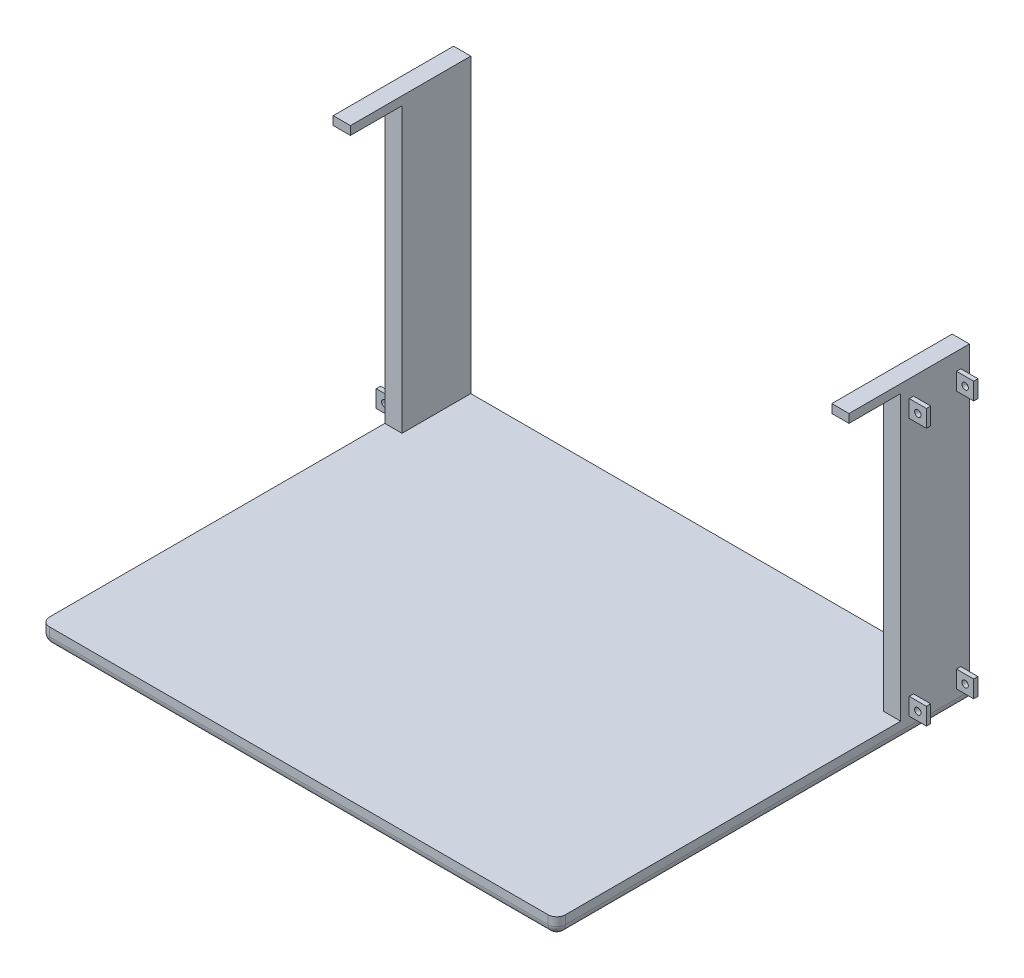
from build123d import *

# Parameters (mm, degrees)
SKETCH1_W                                      = 762
SKETCH1_H                                      = 381
BASE_STRUCTURE_DEPTH                           = 609.6
SKETCH3_W                                      = 711.2
SKETCH3_H                                      = 330.2
SHELL_CUT_DEPTH                                = 584.2
SKETCH5_W                                      = 25.4
SKETCH5_H                                      = 25.4
SKETCH5_R                                      = 4.7625
STABILITY_HOLDER_CUT_FOR_TOP_DEPTH             = 38.1
SKETCH7_W                                      = 63.5
SKETCH7_H                                      = 25.4
INSUDE_CUT_OF_STABILITY_HOLDERS_DEPTH          = 25.4
SKETCH14_W                                     = 711.2
SKETCH14_H                                     = 25.4
TOP_SHELLING_DEPTH                             = 406.4
SKETCH16_W                                     = 711.2
SKETCH16_H                                     = 50.8
BOTTOM_EXTENSION_DEPTH                         = 609.6
SKETCH16_6_W                                   = 711.2
SKETCH16_6_H                                   = 25.4
SKETCH16_6_H_2                                 = 50.8
BOTTOM_SHELLING_DEPTH                          = 584.2
SKETCH17_W                                     = 63.5
SKETCH17_H                                     = 25.4
BOTTOM_STABILTY_HOLDER_SHELL_CUT_DEPTH         = 25.4
SKETCH18_W                                     = 508
SKETCH18_H                                     = 406.4
F_3_4SHELL_FRONT_CHASSIS_CUT_DEPTH             = 1048.576803867
FILLET_CORNER_OF_FRONT_CHASSIS_R               = 12.7
SKETCH95_W                                     = 508
SKETCH95_H                                     = 25.4
CUT_TOP_EXTRUSION_OF_CHASSIS_DEPTH             = 1048.576803867
SKETCH171_W                                    = 76.290149759
SKETCH171_H                                    = 12.7
EXTRUSION_OF_STEERING_RACK_HOLDER_DEPTH        = 25.4
SKETCH172_W                                    = 76.2
SKETCH172_H                                    = 12.7
EXTRUSION_OF_OTHER_STEERING_RACK_HOLDER_DEPTH  = 25.4
MIRRORS_STABILITY_HOLDERS_COPY_1_SKETCH_W      = 25.4
MIRRORS_STABILITY_HOLDERS_COPY_1_SKETCH_H      = 25.4
MIRRORS_STABILITY_HOLDERS_COPY_1_SKETCH_R      = 4.7625
MIRRORS_STABILITY_HOLDERS_COPY_1_DEPTH         = 38.1
SKETCH173_W                                    = 63.5
SKETCH173_H                                    = 406.4
EXTRUSION_OF_OTHER_STABILITY_HOLDERS_TOP_DEPTH = 25.4
FILLET_OF_RIGHT_CORNER_OF_FRONT_CHASSIS_R      = 12.7
FILLET_OF_BOTTOM_SIDE_OF_FRONT_CHASSIS_R       = 12.7


with BuildPart() as part:
    # Sketch1 → Base Structure (new body)
    with BuildSketch(Plane.XY):
        with Locations((381, 190.5)):
            Rectangle(SKETCH1_W, SKETCH1_H)
    extrude(amount=-BASE_STRUCTURE_DEPTH)

    # Sketch3 → Shell Cut (cut)
    with BuildSketch(Plane(origin=(0, 0, -609.6), x_dir=(-1, 0, 0), z_dir=(0, 0, -1))):
        with Locations((-381, 190.5)):
            Rectangle(SKETCH3_W, SKETCH3_H)
    extrude(amount=-SHELL_CUT_DEPTH, mode=Mode.SUBTRACT)

    # Sketch5 → Stability Holder Cut for Top (add, symmetric)
    with BuildSketch(Plane.XY.offset(-558.8)):
        with Locations((774.7, 342.9)):
            Rectangle(SKETCH5_W, SKETCH5_H)
        with Locations(Location((774.7, 342.9, 0), (0, 0, 180))):
            Circle(SKETCH5_R, mode=Mode.SUBTRACT)
    stability_holder_cut_for_top = extrude(amount=STABILITY_HOLDER_CUT_FOR_TOP_DEPTH, both=True)

    # Sketch7 → Insude Cut of Stability Holders (cut)
    with BuildSketch(Plane(origin=(787.4, 0, 0), x_dir=(0, 0, -1), z_dir=(1, 0, 0))):
        with Locations((558.8, 342.9)):
            Rectangle(SKETCH7_W, SKETCH7_H)
    extrude(amount=-INSUDE_CUT_OF_STABILITY_HOLDERS_DEPTH, mode=Mode.SUBTRACT)

    # Sketch14 → Top Shelling (cut)
    with BuildSketch(Plane(origin=(0, 0, -609.6), x_dir=(-1, 0, 0), z_dir=(0, 0, -1))):
        with Locations((-381, 368.3)):
            Rectangle(SKETCH14_W, SKETCH14_H)
    extrude(amount=-TOP_SHELLING_DEPTH, mode=Mode.SUBTRACT)

    # Sketch16 → Bottom Extension (add)
    with BuildSketch(Plane(origin=(0, 0, -609.6), x_dir=(-1, 0, 0), z_dir=(0, 0, -1))):
        Polygon((-736.6, -50.8), (-736.6, 0), (-762, 0), (-762, -76.2), (0, -76.2), (0, 0), (-25.4, 0), (-25.4, -50.8), align=None)
        with Locations((-381, -25.4)):
            Rectangle(SKETCH16_W, SKETCH16_H)
    extrude(amount=-BOTTOM_EXTENSION_DEPTH)

    # Sketch16<6> → Bottom Shelling (cut)
    with BuildSketch(Plane(origin=(0, 0, -609.6), x_dir=(-1, 0, 0), z_dir=(0, 0, -1))):
        with Locations((-381, 12.7)):
            Rectangle(SKETCH16_6_W, SKETCH16_6_H)
        with Locations((-381, -25.4)):
            Rectangle(SKETCH16_6_W, SKETCH16_6_H_2)
    extrude(amount=-BOTTOM_SHELLING_DEPTH, mode=Mode.SUBTRACT)

    # Mirror5: Stability Holder Cut for Top across plane
    add(stability_holder_cut_for_top.mirror(Plane.ZX.offset(152.4)))

    # Sketch17 → Bottom Stabilty Holder Shell Cut (cut)
    with BuildSketch(Plane(origin=(787.4, 0, 0), x_dir=(0, 0, -1), z_dir=(1, 0, 0))):
        with Locations((558.8, -38.1)):
            Rectangle(SKETCH17_W, SKETCH17_H)
    extrude(amount=-BOTTOM_STABILTY_HOLDER_SHELL_CUT_DEPTH, mode=Mode.SUBTRACT)

    # Sketch18 → 3/4Shell Front Chassis Cut (cut, through all)
    with BuildSketch(Plane(origin=(762, 0, 0), x_dir=(0, 0, -1), z_dir=(1, 0, 0))):
        with Locations((254, 152.4)):
            Rectangle(SKETCH18_W, SKETCH18_H)
    extrude(amount=-F_3_4SHELL_FRONT_CHASSIS_CUT_DEPTH, mode=Mode.SUBTRACT)

    # Fillet Corner of Front Chassis
    fillet_corner_of_front_chassis_edges = [part.edges().sort_by_distance(p)[0] for p in [
        (762, -63.5, 0),
    ]]
    fillet(fillet_corner_of_front_chassis_edges, radius=FILLET_CORNER_OF_FRONT_CHASSIS_R)

    # Sketch95 → Cut Top Extrusion of Chassis (cut, through all)
    with BuildSketch(Plane(origin=(762, 0, 0), x_dir=(0, 0, -1), z_dir=(1, 0, 0))):
        with Locations((254, 368.3)):
            Rectangle(SKETCH95_W, SKETCH95_H)
    extrude(amount=-CUT_TOP_EXTRUSION_OF_CHASSIS_DEPTH, mode=Mode.SUBTRACT)

    # Sketch171 → Extrusion of Steering Rack Holder (add)
    with BuildSketch(Plane(origin=(762, 0, 0), x_dir=(0, 0, -1), z_dir=(1, 0, 0))):
        with Locations((469.854925121, 374.65)):
            Rectangle(SKETCH171_W, SKETCH171_H)
    extrude(amount=-EXTRUSION_OF_STEERING_RACK_HOLDER_DEPTH)

    # Sketch172 → Extrusion of Other Steering Rack Holder (add)
    with BuildSketch(Plane.ZY):
        with Locations((-469.9, 374.65)):
            Rectangle(SKETCH172_W, SKETCH172_H)
    extrude(amount=-EXTRUSION_OF_OTHER_STEERING_RACK_HOLDER_DEPTH)

    # Mirrors Stability Holders: Stability Holder Cut for Top across plane
    add(stability_holder_cut_for_top.mirror(Plane(origin=(381, 0, 0), x_dir=(0, 0, 1), z_dir=(1, 0, 0))))

    # Mirrors Stability Holders copy 1 sketch → Mirrors Stability Holders copy 1 (add, symmetric)
    with BuildSketch(Plane(origin=(762, 304.8, -558.8), x_dir=(-1, 0, 0), z_dir=(0, 0, 1))):
        with Locations((774.7, 342.9)):
            Rectangle(MIRRORS_STABILITY_HOLDERS_COPY_1_SKETCH_W, MIRRORS_STABILITY_HOLDERS_COPY_1_SKETCH_H)
        with Locations(Location((774.7, 342.9, 0), (0, 0, 180))):
            Circle(MIRRORS_STABILITY_HOLDERS_COPY_1_SKETCH_R, mode=Mode.SUBTRACT)
    extrude(amount=MIRRORS_STABILITY_HOLDERS_COPY_1_DEPTH, both=True)

    # Sketch173 → Extrusion of Other Stability Holders Top and Bottom (cut)
    with BuildSketch(Plane.ZY.offset(25.4)):
        with Locations((-558.8, 152.4)):
            Rectangle(SKETCH173_W, SKETCH173_H)
    extrude(amount=-EXTRUSION_OF_OTHER_STABILITY_HOLDERS_TOP_DEPTH, mode=Mode.SUBTRACT)

    # Fillet of Right Corner of Front Chassis
    fillet_of_right_corner_of_front_chassis_edges = [part.edges().sort_by_distance(p)[0] for p in [
        (0, -63.5, 0),
    ]]
    fillet(fillet_of_right_corner_of_front_chassis_edges, radius=FILLET_OF_RIGHT_CORNER_OF_FRONT_CHASSIS_R)

    # Fillet of Bottom Side of Front Chassis
    fillet_of_bottom_side_of_front_chassis_edges = [part.edges().sort_by_distance(p)[0] for p in [
        (381, -76.2, 0),
        (762, -76.2, -311.15),
        (758.280256121, -76.2, -3.719743879),
        (0, -76.2, -311.15),
        (3.719743879, -76.2, -3.719743879),
    ]]
    fillet(fillet_of_bottom_side_of_front_chassis_edges, radius=FILLET_OF_BOTTOM_SIDE_OF_FRONT_CHASSIS_R)


solid = part.part
